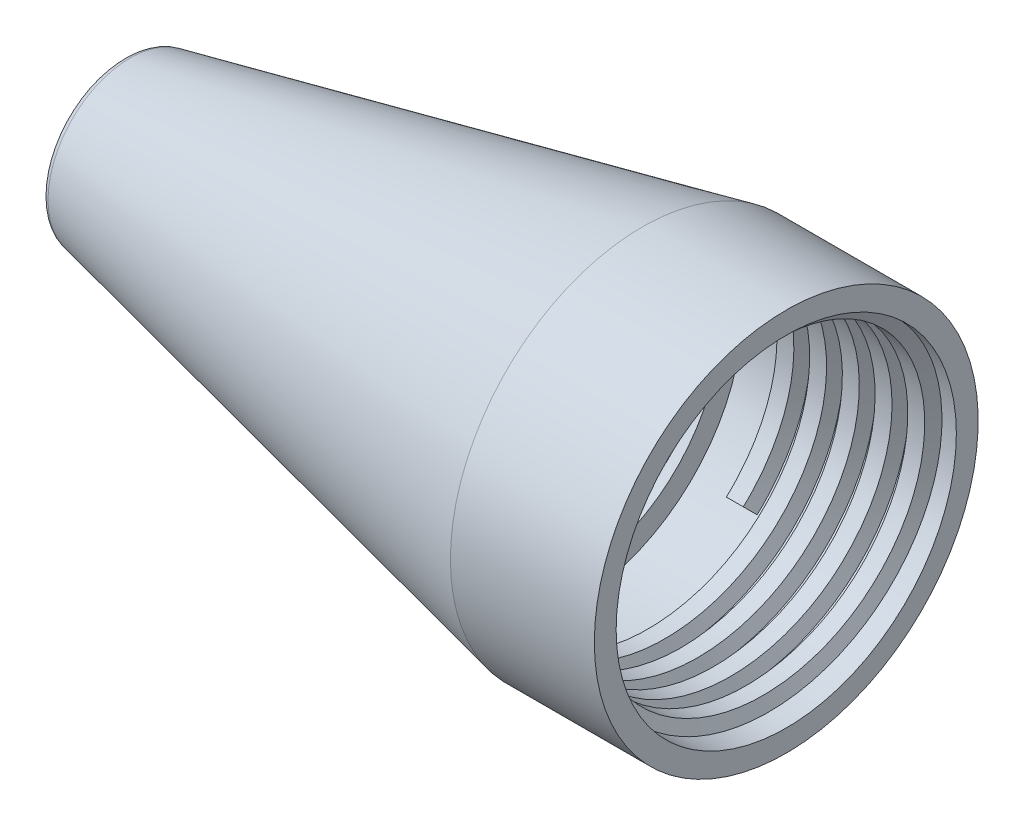
from build123d import *

# Parameters (mm, degrees)
VARREDURA1_PITCH       = 0.75
VARREDURA1_HEIGHT      = 3.375
VARREDURA1_RADIUS      = 3.9
VARREDURA1_START_ANGLE = -135


with BuildPart() as part:
    # Esboço1 → Revolução1 (revolve)
    with BuildSketch(Plane.XY, mode=Mode.PRIVATE) as revolu_o1_sk:
        with BuildLine():
            Line((2.14, 1.628225988), (10.3, 3.376797417))
            Line((10.3, 3.376797417), (10.3, 3.9))
            Line((10.3, 3.9), (15.2, 3.9))
            Line((15.2, 3.9), (15.2, 4.4))
            Line((15.2, 4.4), (11.9, 4.4))
            Line((11.9, 4.4), (0.158094182, 1.883877325))
            ThreePointArc((0.158094182, 1.883877325), (0.044466782, 1.814052351), (0, 1.688316842))
            Line((0, 1.688316842), (0, 1.2))
            Line((0, 1.2), (2.14, 1.2))
            Line((2.14, 1.2), (2.14, 1.628225988))
        make_face()
    revolve(revolu_o1_sk.sketch.rotate(Axis((0, 0, 0), (1, 0, 0)), 90), axis=Axis((0, 0, 0), (1, 0, 0)))

    # Varredura1: sweep along a helix
    with BuildLine() as varredura1_path:
        add(Helix(VARREDURA1_PITCH, VARREDURA1_HEIGHT, VARREDURA1_RADIUS, center=(15.2, 0, 0), direction=(-1, 0, 0), mode=Mode.PRIVATE).rotate(Axis((15.2, 0, 0), (-1, 0, 0)), VARREDURA1_START_ANGLE))
    # Esboço7 → Varredura1 (sweep)
    with BuildSketch(Plane.XY):
        Polygon((15.058994306, 3.906535864), (14.926057291, 3.634619244), (14.538405916, 3.634619244), (14.405468902, 3.906535864), (14.405468902, 4.002470549), (15.058994306, 4.002470549), align=None)
    sweep(path=varredura1_path.line, is_frenet=True)


solid = part.part
